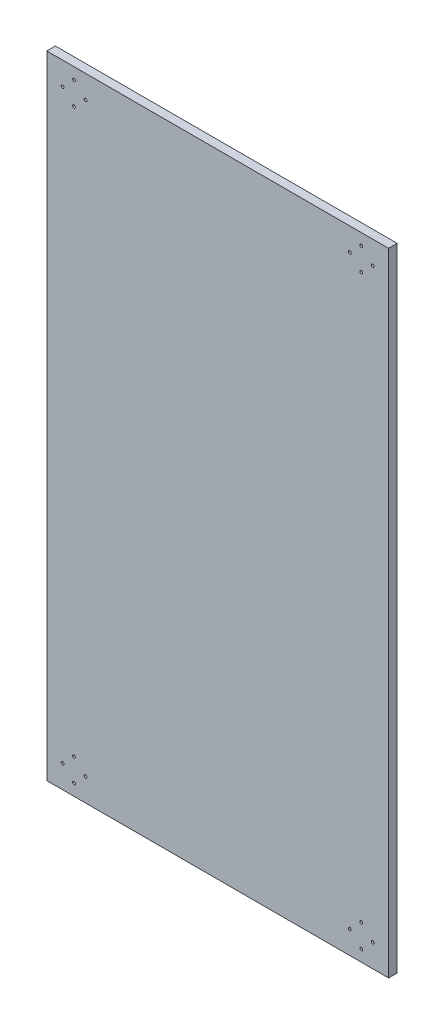
from build123d import *

# Parameters (mm, degrees)
SKETCH1_W           = 755.65
SKETCH1_H           = 1397
BOSS_EXTRUDE1_DEPTH = 19.05
SKETCH2_R           = 3.175
CUT_EXTRUDE1_DEPTH  = 25.4


with BuildPart() as part:
    # Sketch1 → Boss-Extrude1 (new body)
    with BuildSketch(Plane.XY):
        with Locations((377.825, 698.5)):
            Rectangle(SKETCH1_W, SKETCH1_H)
    extrude(amount=BOSS_EXTRUDE1_DEPTH)

    # Sketch2 → Cut-Extrude1 (cut)
    with BuildSketch(Plane.XY.offset(19.05)):
        with Locations((60.325, 76.2)):
            Circle(SKETCH2_R)
        with Locations((60.325, 25.4)):
            Circle(SKETCH2_R)
        with Locations((34.925, 50.8)):
            Circle(SKETCH2_R)
        with Locations((85.725, 50.8)):
            Circle(SKETCH2_R)
        with Locations((669.925, 50.8)):
            Circle(SKETCH2_R)
        with Locations((720.725, 50.8)):
            Circle(SKETCH2_R)
        with Locations((695.325, 25.4)):
            Circle(SKETCH2_R)
        with Locations((695.325, 76.2)):
            Circle(SKETCH2_R)
        with Locations((695.325, 1320.8)):
            Circle(SKETCH2_R)
        with Locations((695.325, 1371.6)):
            Circle(SKETCH2_R)
        with Locations((720.725, 1346.2)):
            Circle(SKETCH2_R)
        with Locations((669.925, 1346.2)):
            Circle(SKETCH2_R)
        with Locations((85.725, 1346.2)):
            Circle(SKETCH2_R)
        with Locations((34.925, 1346.2)):
            Circle(SKETCH2_R)
        with Locations((60.325, 1371.6)):
            Circle(SKETCH2_R)
        with Locations((60.325, 1320.8)):
            Circle(SKETCH2_R)
    extrude(amount=-CUT_EXTRUDE1_DEPTH, mode=Mode.SUBTRACT)


solid = part.part
